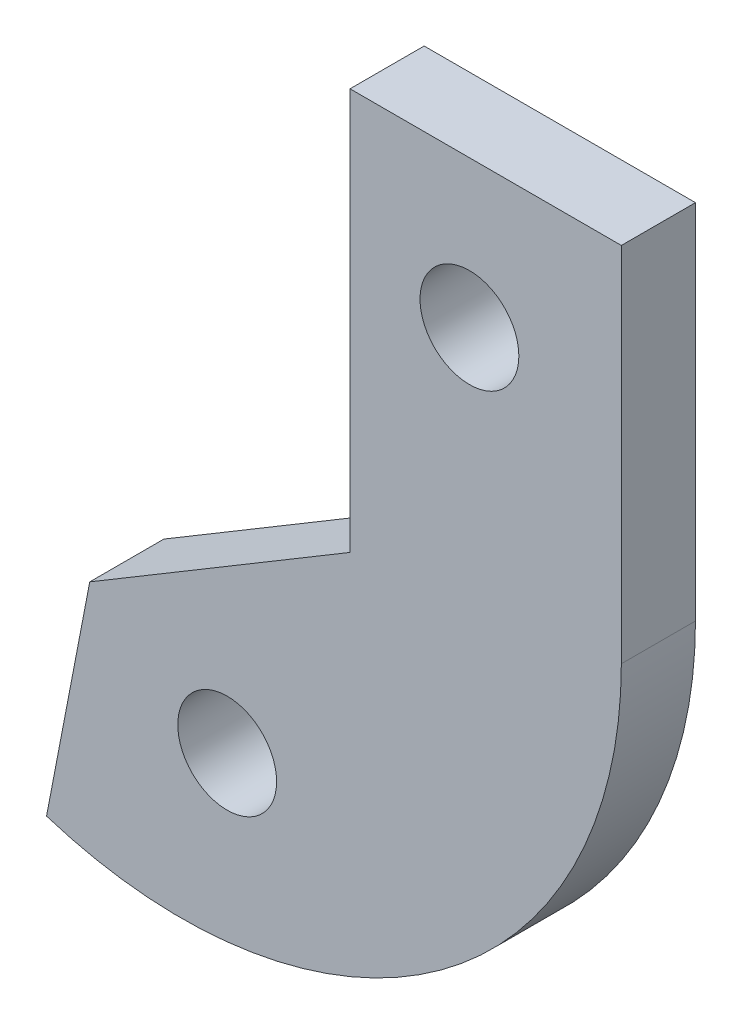
from build123d import *

# Parameters (mm, degrees)
SKETCH2_R           = 2
BOSS_EXTRUDE1_DEPTH = 3


with BuildPart() as part:
    # Sketch2 → Boss-Extrude1 (new body)
    with BuildSketch(Plane(origin=(0, 0, 0), x_dir=(-1, 0, 0), z_dir=(0, 0, 1))):
        with BuildLine():
            Line((-9.017950721, -7.332311194), (-20, -7.332311194))
            Line((-20, -7.332311194), (-20, 7.332311194))
            ThreePointArc((-20, 7.332311194), (-12.680293068, 21.732536084), (3.26719031, 24.305930805))
            Line((3.26719031, 24.305930805), (1.518352245, 15.220414118))
            Line((1.518352245, 15.220414118), (-9.017950721, 8.920221357))
            Line((-9.017950721, 8.920221357), (-9.017950721, -7.332311194))
        make_face()
        with Locations(Location((-13.851036571, -1.379219301, 0), (0, 0, 180))):
            Circle(SKETCH2_R, mode=Mode.SUBTRACT)
        with Locations(Location((-4.045326452, 18.443425538, 0), (0, 0, 180))):
            Circle(SKETCH2_R, mode=Mode.SUBTRACT)
    extrude(amount=BOSS_EXTRUDE1_DEPTH)


solid = part.part
